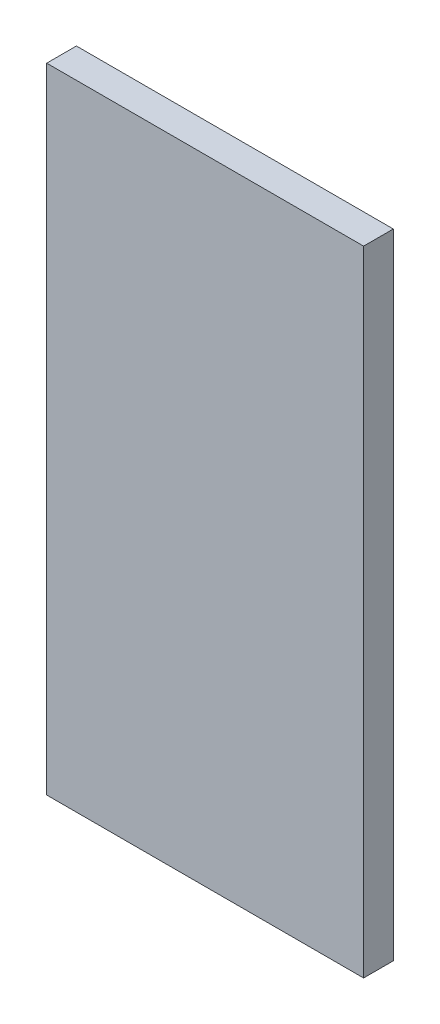
from build123d import *

# Parameters (mm, degrees)
SKETCH1_W           = 203.2
SKETCH1_H           = 406.4
BOSS_EXTRUDE1_DEPTH = 19.05


with BuildPart() as part:
    # Sketch1 → Boss-Extrude1 (new body)
    with BuildSketch(Plane.XY):
        with Locations((101.6, 203.2)):
            Rectangle(SKETCH1_W, SKETCH1_H)
    extrude(amount=BOSS_EXTRUDE1_DEPTH)


solid = part.part
